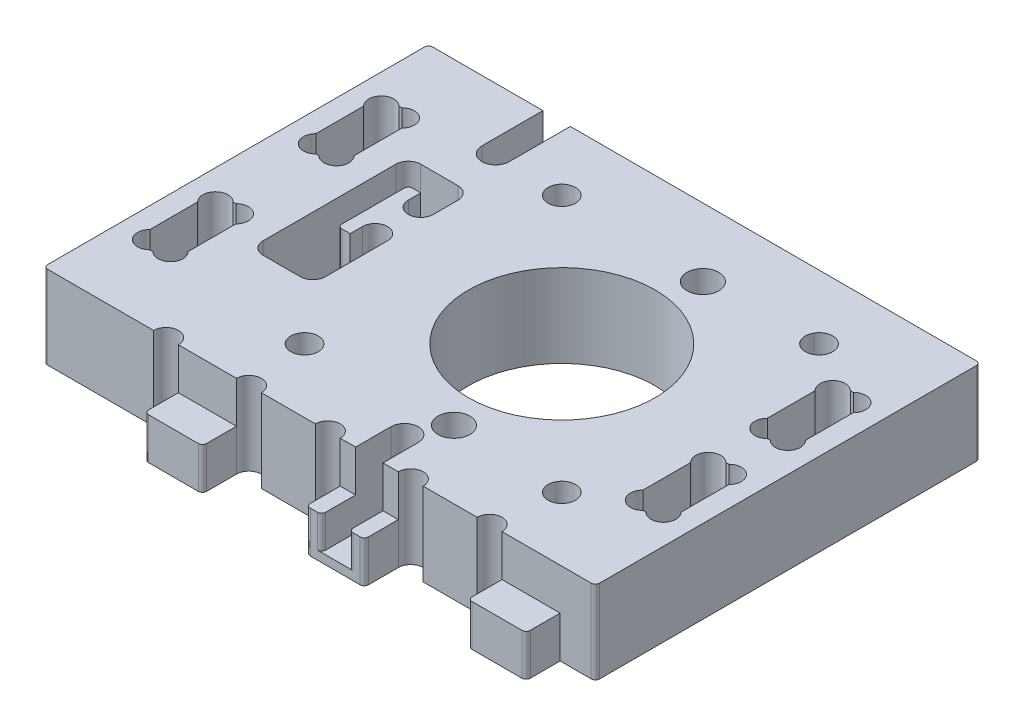
from build123d import *

# Parameters (mm, degrees)
SKETCH1_R           = 1.925
BOSS_EXTRUDE1_DEPTH = 10
SKETCH2_R           = 11.25
SKETCH2_R_2         = 1.65
CUT_EXTRUDE1_DEPTH  = 49.845189118
SKETCH7_W           = 46
SKETCH7_H           = 4.1
CUT_EXTRUDE6_DEPTH  = 5
SKETCH10_W          = 4.6
SKETCH10_H          = 10
CUT_EXTRUDE8_DEPTH  = 10
CUT_EXTRUDE7_DEPTH  = 49.845189118
SKETCH13_W          = 7
SKETCH13_H          = 5
BOSS_EXTRUDE2_DEPTH = 1
CUT_EXTRUDE9_DEPTH  = 8.95
FILLET7_R           = 0.5
CUT_EXTRUDE10_DEPTH = 49.845189118
FILLET8_R           = 0.5
FILLET9_R           = 1.5


with BuildPart() as part:
    # Sketch1 → Boss-Extrude1 (new body)
    with BuildSketch(Plane(origin=(0, 0, 0), x_dir=(1, 0, 0), z_dir=(0, 1, 0))):
        Polygon((16, -23.2), (3.5, -23.2), (3.5, -27.3), (-3.5, -27.3), (-3.5, -23.2), (-16, -23.2), (-16, -27.3), (-23, -27.3), (-23, -23.2), (-39.25, -23.2), (-39.25, 23.2), (-23, 23.2), (23, 23.2), (27.25, 23.2), (27.25, -23.2), (23, -23.2), (23, -27.3), (16, -27.3), align=None)
        with Locations((2, -15)):
            Circle(SKETCH1_R, mode=Mode.SUBTRACT)
        with Locations((2, 15)):
            Circle(SKETCH1_R, mode=Mode.SUBTRACT)
    extrude(amount=BOSS_EXTRUDE1_DEPTH)

    # Sketch2 → Cut-Extrude1 (cut, through all)
    with BuildSketch(Plane(origin=(0, 10, 0), x_dir=(1, 0, 0), z_dir=(0, 1, 0))):
        Circle(SKETCH2_R)
        with Locations((-15.5, 15.5)):
            Circle(SKETCH2_R_2)
        with Locations((15.5, 15.5)):
            Circle(SKETCH2_R_2)
        with Locations((15.5, -15.5)):
            Circle(SKETCH2_R_2)
        with Locations((-15.5, -15.5)):
            Circle(SKETCH2_R_2)
    extrude(amount=-CUT_EXTRUDE1_DEPTH, mode=Mode.SUBTRACT)

    # Sketch7 → Cut-Extrude6 (cut)
    with BuildSketch(Plane(origin=(0, 10, 0), x_dir=(1, 0, 0), z_dir=(0, 1, 0))):
        with Locations((0, -25.25)):
            Rectangle(SKETCH7_W, SKETCH7_H)
    extrude(amount=-CUT_EXTRUDE6_DEPTH, mode=Mode.SUBTRACT)

    # Sketch10 → Cut-Extrude8 (cut)
    with BuildSketch(Plane(origin=(0, 10, 0), x_dir=(1, 0, 0), z_dir=(0, 1, 0))):
        with Locations((-34.45, 10)):
            Rectangle(SKETCH10_W, SKETCH10_H)
        with Locations((-34.45, -10)):
            Rectangle(SKETCH10_W, SKETCH10_H)
        with Locations((22.45, 7.5)):
            Rectangle(SKETCH10_W, SKETCH10_H)
        with Locations((22.45, -7.5)):
            Rectangle(SKETCH10_W, SKETCH10_H)
    extrude(amount=-CUT_EXTRUDE8_DEPTH, mode=Mode.SUBTRACT)

    # Sketch8 → Cut-Extrude7 (cut, through all)
    with BuildSketch(Plane.XZ):
        with BuildLine():
            Line((-23, 23.2), (-23, 27.3))
            ThreePointArc((-23, 27.3), (-24.5, 28.8), (-26, 27.3))
            Line((-26, 27.3), (-26, 23.2))
            ThreePointArc((-26, 23.2), (-24.5, 21.7), (-23, 23.2))
        make_face()
        with BuildLine():
            Line((13, 23.2), (13, 27.3))
            ThreePointArc((13, 27.3), (14.5, 28.8), (16, 27.3))
            Line((16, 27.3), (16, 23.2))
            ThreePointArc((16, 23.2), (14.5, 21.7), (13, 23.2))
        make_face()
        with BuildLine():
            Line((6.5, 27.3), (6.5, 23.2))
            ThreePointArc((6.5, 23.2), (5, 21.7), (3.5, 23.2))
            Line((3.5, 23.2), (3.5, 27.3))
            ThreePointArc((3.5, 27.3), (5, 28.8), (6.5, 27.3))
        make_face()
        with BuildLine():
            Line((-13, 23.2), (-13, 27.3))
            ThreePointArc((-13, 27.3), (-14.5, 28.8), (-16, 27.3))
            Line((-16, 27.3), (-16, 23.2))
            ThreePointArc((-16, 23.2), (-14.5, 21.7), (-13, 23.2))
        make_face()
        with BuildLine():
            Line((-6.5, 27.3), (-6.5, 23.2))
            ThreePointArc((-6.5, 23.2), (-5, 21.7), (-3.5, 23.2))
            Line((-3.5, 23.2), (-3.5, 27.3))
            ThreePointArc((-3.5, 27.3), (-5, 28.8), (-6.5, 27.3))
        make_face()
        with BuildLine():
            ThreePointArc((22.45, 12.284346805), (25.189339828, 11.439339828), (22.45, 10.594332852))
            ThreePointArc((22.45, 10.594332852), (19.710660172, 11.439339828), (22.45, 12.284346805))
        make_face()
        with BuildLine():
            ThreePointArc((22.45, 2.715653195), (25.189339828, 3.560660172), (22.45, 4.405667148))
            ThreePointArc((22.45, 4.405667148), (19.710660172, 3.560660172), (22.45, 2.715653195))
        make_face()
        with BuildLine():
            ThreePointArc((-34.45, -14.784346805), (-37.189339828, -13.939339828), (-34.45, -13.094332852))
            ThreePointArc((-34.45, -13.094332852), (-31.710660172, -13.939339828), (-34.45, -14.784346805))
        make_face()
        with BuildLine():
            ThreePointArc((-34.45, -5.215653195), (-37.189339828, -6.060660172), (-34.45, -6.905667148))
            ThreePointArc((-34.45, -6.905667148), (-31.710660172, -6.060660172), (-34.45, -5.215653195))
        make_face()
        with BuildLine():
            ThreePointArc((-34.45, 14.784346805), (-31.710660172, 13.939339828), (-34.45, 13.094332852))
            ThreePointArc((-34.45, 13.094332852), (-37.189339828, 13.939339828), (-34.45, 14.784346805))
        make_face()
        with BuildLine():
            ThreePointArc((-34.45, 5.215653195), (-31.710660172, 6.060660172), (-34.45, 6.905667148))
            ThreePointArc((-34.45, 6.905667148), (-37.189339828, 6.060660172), (-34.45, 5.215653195))
        make_face()
        with BuildLine():
            ThreePointArc((22.45, -12.284346805), (19.710660172, -11.439339828), (22.45, -10.594332852))
            ThreePointArc((22.45, -10.594332852), (25.189339828, -11.439339828), (22.45, -12.284346805))
        make_face()
        with BuildLine():
            ThreePointArc((22.45, -2.715653195), (19.710660172, -3.560660172), (22.45, -4.405667148))
            ThreePointArc((22.45, -4.405667148), (25.189339828, -3.560660172), (22.45, -2.715653195))
        make_face()
    extrude(amount=-CUT_EXTRUDE7_DEPTH, mode=Mode.SUBTRACT)

    # Sketch13 → Boss-Extrude2 (add)
    with BuildSketch(Plane(origin=(0, 0, -23.2), x_dir=(-1, 0, 0), z_dir=(0, 0, -1))):
        with Locations((23.83, 2.5)):
            Rectangle(SKETCH13_W, SKETCH13_H)
    extrude(amount=BOSS_EXTRUDE2_DEPTH)

    # Sketch12 → Cut-Extrude9 (cut)
    with BuildSketch(Plane.XZ.offset(-10)):
        with BuildLine():
            Line((-25.475, -24.2), (-25.475, -15.85))
            ThreePointArc((-25.475, -15.85), (-23.825, -14.2), (-22.175, -15.85))
            Line((-22.175, -15.85), (-22.175, -24.2))
            ThreePointArc((-22.175, -24.2), (-23.825, -25.85), (-25.475, -24.2))
        make_face()
        with BuildLine():
            Line((1.65, 27.3), (1.65, 18.95))
            ThreePointArc((1.65, 18.95), (0, 17.3), (-1.65, 18.95))
            Line((-1.65, 18.95), (-1.65, 27.3))
            ThreePointArc((-1.65, 27.3), (0, 28.95), (1.65, 27.3))
        make_face()
    extrude(amount=CUT_EXTRUDE9_DEPTH, mode=Mode.SUBTRACT)

    # Fillet7
    fillet7_edges = [part.edges().sort_by_distance(p)[0] for p in [
        (-23, 2.5, 27.3),
        (-16, 2.5, 27.3),
        (-3.5, 2.5, 27.3),
        (3.5, 2.5, 27.3),
        (16, 2.5, 27.3),
        (23, 2.5, 27.3),
        (27.25, 5, -23.2),
        (-39.25, 5, -23.2),
        (-39.25, 5, 23.2),
        (27.25, 5, 23.2),
        (-27.33, 2.5, -24.2),
        (-20.33, 2.5, -24.2),
        (-22.175, 3.025, -24.2),
        (-25.475, 3.025, -24.2),
        (1.65, 3.025, 27.3),
        (-1.65, 3.025, 27.3),
    ]]
    fillet(fillet7_edges, radius=FILLET7_R)

    # Sketch14 → Cut-Extrude10 (cut, through all)
    with BuildSketch(Plane.XZ.offset(-10)):
        with BuildLine():
            Line((-21.25, 8.75), (-28.75, 8.75))
            Line((-28.75, 8.75), (-28.75, -8.75))
            ThreePointArc((-28.75, -8.75), (-28.310660172, -9.810660172), (-27.25, -10.25))
            Line((-27.25, -10.25), (-22.75, -10.25))
            ThreePointArc((-22.75, -10.25), (-21.689339828, -9.810660172), (-21.25, -8.75))
            Line((-21.25, -8.75), (-21.25, -5.75))
            ThreePointArc((-21.25, -5.75), (-22.75, -4.25), (-24.25, -5.75))
            Line((-24.25, -5.75), (-24.25, -7.25))
            Line((-24.25, -7.25), (-25.75, -7.25))
            Line((-25.75, -7.25), (-25.75, 1.25))
            Line((-25.75, 1.25), (-24.25, 1.25))
            Line((-24.25, 1.25), (-24.25, -0.25))
            ThreePointArc((-24.25, -0.25), (-22.75, -1.75), (-21.25, -0.25))
            Line((-21.25, -0.25), (-21.25, 8.75))
        make_face()
    extrude(amount=CUT_EXTRUDE10_DEPTH, mode=Mode.SUBTRACT)

    # Fillet8
    fillet8_edges = [part.edges().sort_by_distance(p)[0] for p in [
        (-25.75, 5, -7.25),
        (-25.75, 5, 1.25),
    ]]
    fillet(fillet8_edges, radius=FILLET8_R)

    # Fillet9
    fillet9_edges = [part.edges().sort_by_distance(p)[0] for p in [
        (-21.25, 5, 8.75),
        (-28.75, 5, 8.75),
    ]]
    fillet(fillet9_edges, radius=FILLET9_R)


solid = part.part
